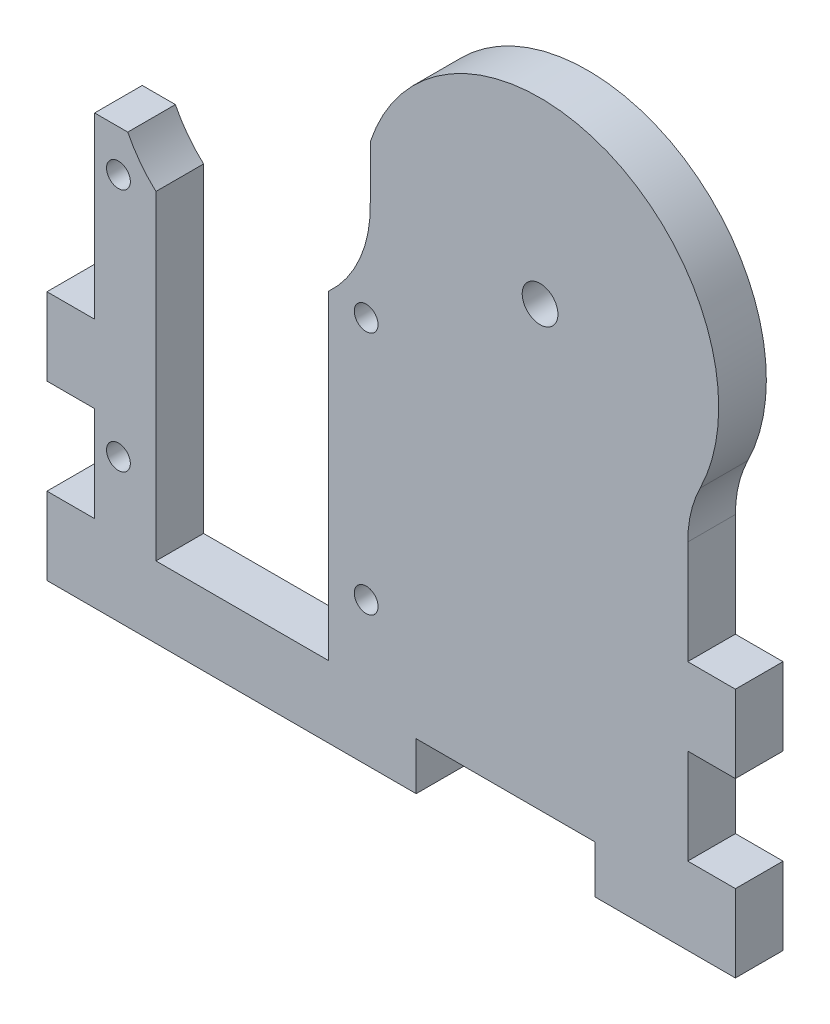
from build123d import *

# Parameters (mm, degrees)
SKETCH_1_R          = 1
SKETCH_1_R_2        = 1.5
EXTRUDE_1_DEPTH     = 4
SKETCH_2_W          = 15
SKETCH_2_H          = 4
CUT_EXTRUDE_1_DEPTH = 10
SKETCH_3_W          = 4
SKETCH_3_H          = 6.5
EXTRUDE_2_DEPTH     = 4


with BuildPart() as part:
    # Эскиз1 → Бобышка-Вытянуть1 (new body)
    with BuildSketch(Plane.XY):
        with BuildLine():
            Line((0, 0), (0, 30))
            Line((0, 30), (2.783140074, 30))
            ThreePointArc((2.783140074, 30), (3.822293637, 28.324390962), (5.15, 26.866755347))
            Line((5.15, 26.866755347), (5.15, 0))
            Line((5.15, 0), (19.65, 0))
            Line((19.65, 0), (19.65, 26.866755347))
            ThreePointArc((19.65, 26.866755347), (22.29801609, 30.609753984), (23.145479479, 35.115731548))
            Line((23.145479479, 35.115731548), (23.145479479, 39.473981947))
            ThreePointArc((23.145479479, 39.473981947), (43.080010933, 48.687001602), (50.84, 28.143198519))
            ThreePointArc((50.84, 28.143198519), (50.063470844, 25.983008862), (49.8, 23.702658011))
            Line((49.8, 23.702658011), (49.8, -6))
            Line((49.8, -6), (0, -6))
            Line((0, -6), (0, 0))
        make_face()
        with Locations((2, 26.5)):
            Circle(SKETCH_1_R, mode=Mode.SUBTRACT)
        with Locations(Location((22.8, 26.5, 0), (0, 0, 180))):
            Circle(SKETCH_1_R, mode=Mode.SUBTRACT)
        with Locations((22.8, 6)):
            Circle(SKETCH_1_R, mode=Mode.SUBTRACT)
        with Locations(Location((2, 6, 0), (0, 0, 180))):
            Circle(SKETCH_1_R, mode=Mode.SUBTRACT)
        with Locations((37.4, 34.80400928)):
            Circle(SKETCH_1_R_2, mode=Mode.SUBTRACT)
    extrude(amount=EXTRUDE_1_DEPTH)

    # Эскиз2 → Вырез-Вытянуть1 (cut)
    with BuildSketch(Plane.XY.offset(4)):
        with Locations((34.5, -4)):
            Rectangle(SKETCH_2_W, SKETCH_2_H)
    extrude(amount=-CUT_EXTRUDE_1_DEPTH, mode=Mode.SUBTRACT)

    # Эскиз3 → Бобышка-Вытянуть2 (add)
    with BuildSketch(Plane.XY.offset(4)):
        with Locations((-2, -2.75)):
            Rectangle(SKETCH_3_W, SKETCH_3_H)
        with Locations((-2, 11.75)):
            Rectangle(SKETCH_3_W, SKETCH_3_H)
        with Locations((51.8, 11.75)):
            Rectangle(SKETCH_3_W, SKETCH_3_H)
        with Locations((51.8, -2.75)):
            Rectangle(SKETCH_3_W, SKETCH_3_H)
    extrude(amount=-EXTRUDE_2_DEPTH)


solid = part.part
